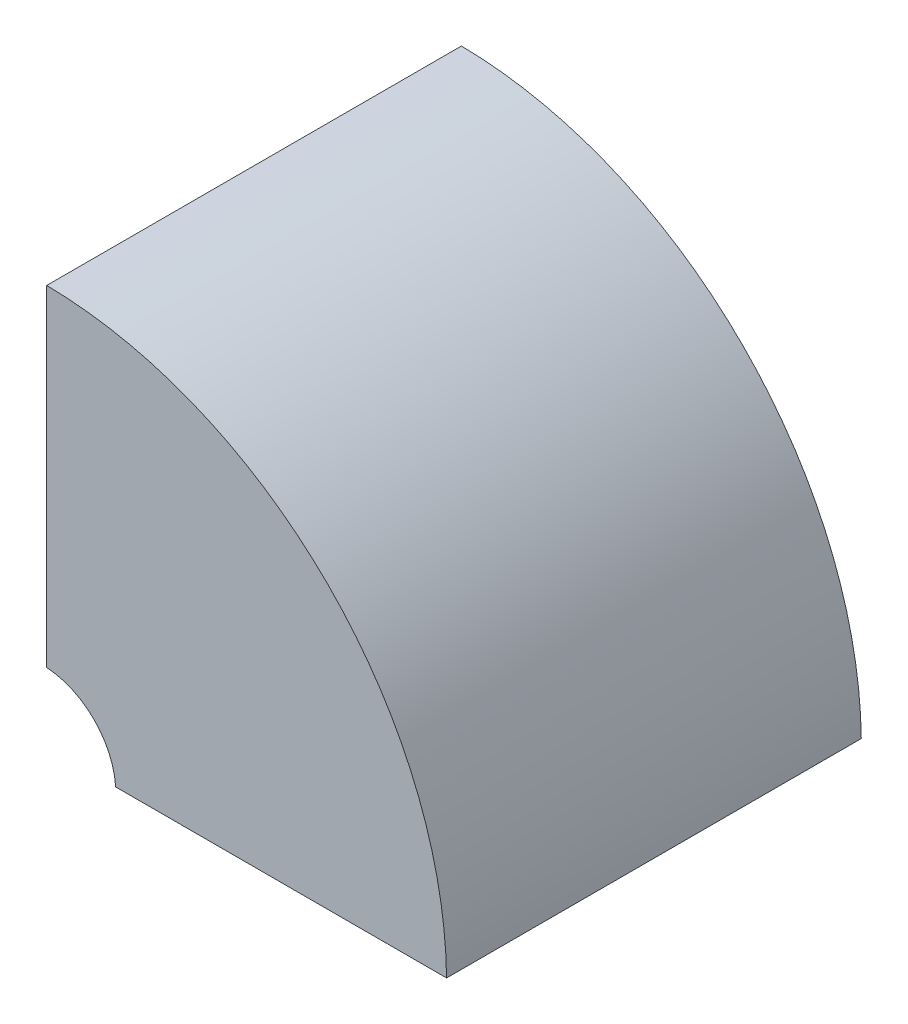
from build123d import *

# Parameters (mm, degrees)
BOSS_EXTRUDE1_DEPTH = 42


with BuildPart() as part:
    # Sketch1 → Boss-Extrude1 (new body)
    with BuildSketch(Plane.XY):
        with BuildLine():
            Line((0.5, 40.996951106), (0.5, 7.483314774))
            ThreePointArc((0.5, 7.483314774), (5.303300859, 5.303300859), (7.483314774, 0.5))
            Line((7.483314774, 0.5), (40.996951106, 0.5))
            ThreePointArc((40.996951106, 0.5), (28.991378029, 28.991378029), (0.5, 40.996951106))
        make_face()
    extrude(amount=-BOSS_EXTRUDE1_DEPTH)


solid = part.part
